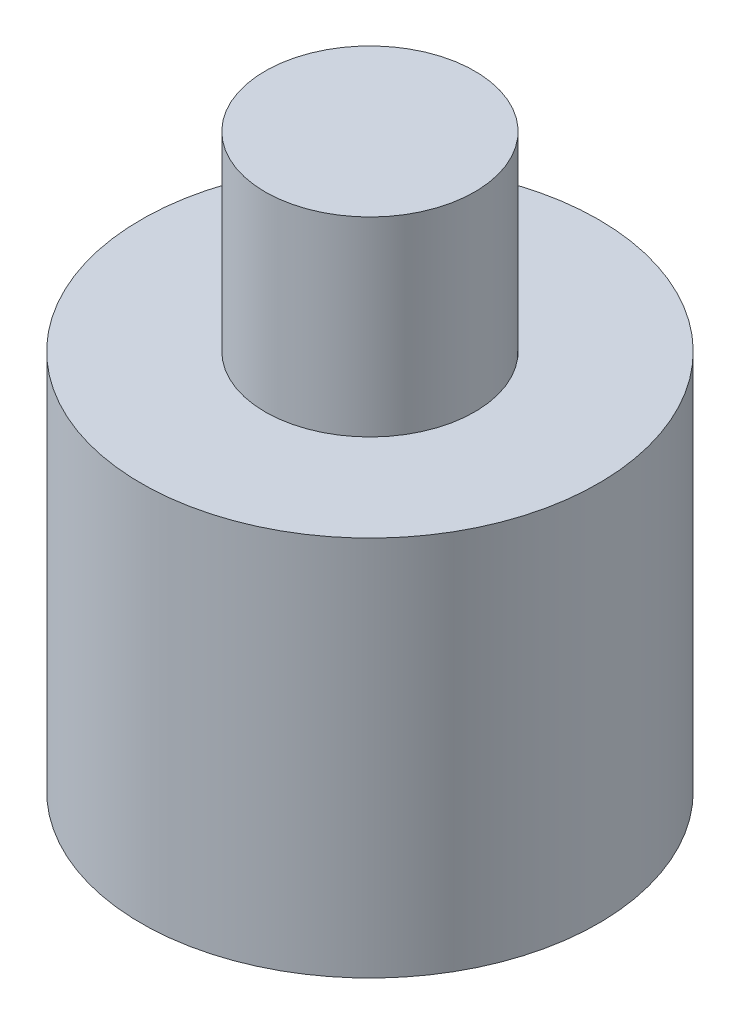
from build123d import *

# Parameters (mm, degrees)
SKETCH2_R           = 2.75
BOSS_EXTRUDE1_DEPTH = 5
SKETCH3_R           = 6
BOSS_EXTRUDE2_DEPTH = 10


with BuildPart() as part:
    # Sketch2 → Boss-Extrude1 (new body)
    with BuildSketch(Plane(origin=(0, 0, 0), x_dir=(1, 0, 0), z_dir=(0, 1, 0))):
        with Locations(Location((0, 0, 0), (0, 0, 270))):
            Circle(SKETCH2_R)
    extrude(amount=-BOSS_EXTRUDE1_DEPTH)

    # Sketch3 → Boss-Extrude2 (add)
    with BuildSketch(Plane(origin=(0, -5, 0), x_dir=(-1, 0, 0), z_dir=(0, -1, 0))):
        with Locations(Location((0, 0, 0), (0, 0, 90))):
            Circle(SKETCH3_R)
    extrude(amount=BOSS_EXTRUDE2_DEPTH)


solid = part.part
